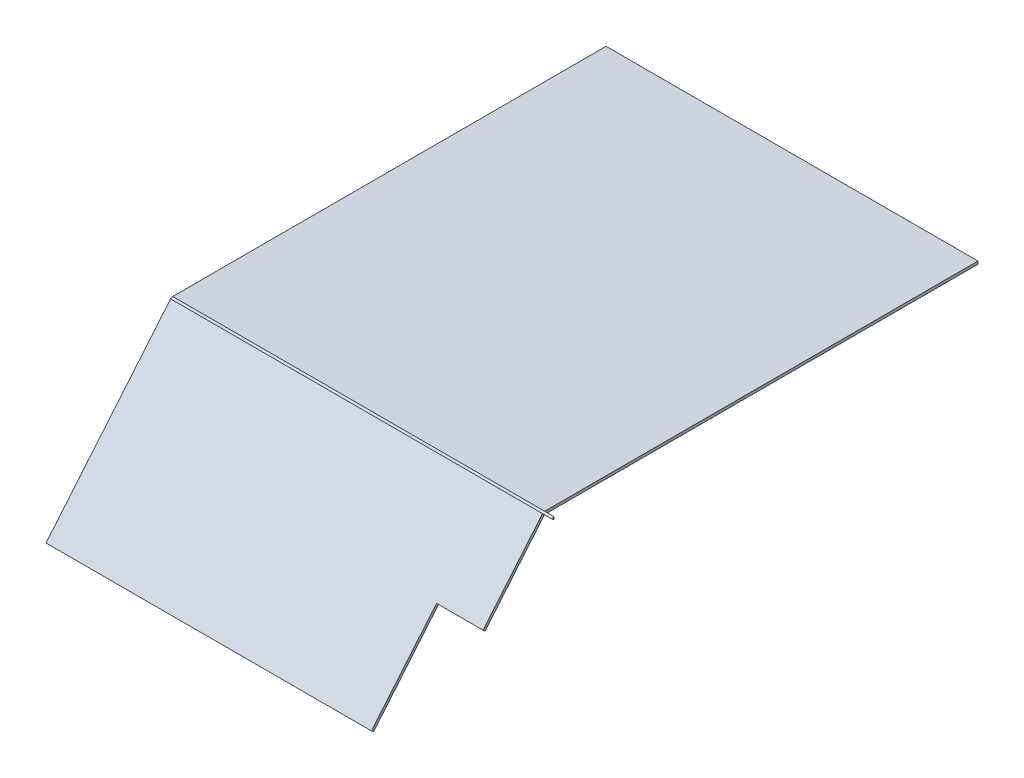
from build123d import *

# Parameters (mm, degrees)
BOSS_EXTRUDE1_DEPTH = 3
BOSS_EXTRUDE3_DEPTH = 3
BOSS_EXTRUDE4_START = -10
BOSS_EXTRUDE4_DEPTH = 410


with BuildPart() as part:
    # 3DSketch1 → Boss-Extrude1 (new body)
    with BuildSketch(Plane(origin=(-317.933582459, 130.294447415, 321.791546701), x_dir=(0.6513102781690263, 0, 0.7588115191214388), z_dir=(0, -1, 0))):
        Polygon((0, 0), (353.62249966, 303.524607649), (614.146610928, 0), (260.524111268, -303.524607649), align=None)
    extrude(amount=-BOSS_EXTRUDE1_DEPTH)



with BuildPart() as body_2:
    # Sketch2 → Boss-Extrude3 (new body)
    with BuildSketch(Plane(origin=(0, 441.171604384, 528.116012859), x_dir=(1, 0, 0), z_dir=(0, 0.6411058174679163, 0.7674524941706782))):
        Polygon((-317.933582459, -614.057029458), (-317.933582459, -405.07674329), (82.066417541, -405.07674329), (82.066417541, -504.870685967), (32.066417541, -504.870685967), (32.066417541, -614.057029458), align=None)
    extrude(amount=BOSS_EXTRUDE3_DEPTH)


with BuildPart() as part_1:
    add(part.part)

    add(body_2.part)  # Boss-Extrude4 merges body 2
    # Sketch3 → Boss-Extrude4 (add)
    with BuildSketch(Plane.ZY.offset(327.933582459).offset(BOSS_EXTRUDE4_START)):
        Polygon((787.813069503, 130.294447415), (787.813069503, 133.294447415), (790.115426985, 132.217764868), align=None)
    extrude(amount=-BOSS_EXTRUDE4_DEPTH)


solid = part_1.part
